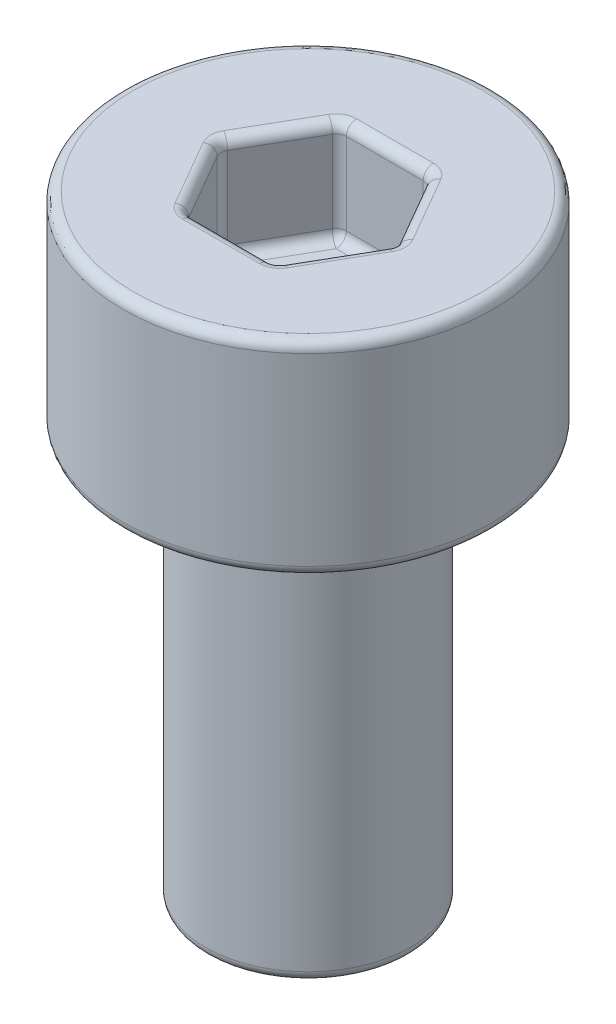
from build123d import *

# Parameters (mm, degrees)
SKETCH1_R           = 2
BOSS_EXTRUDE1_DEPTH = 8
SKETCH2_R           = 3.61
BOSS_EXTRUDE2_DEPTH = 4
CUT_EXTRUDE1_DEPTH  = 2
FILLET1_R           = 0.2


with BuildPart() as part:
    # Sketch1 → Boss-Extrude1 (new body)
    with BuildSketch(Plane(origin=(0, 0, 0), x_dir=(1, 0, 0), z_dir=(0, 1, 0))):
        with Locations(Location((0, 0, 0), (0, 0, 270))):
            Circle(SKETCH1_R)
    extrude(amount=-BOSS_EXTRUDE1_DEPTH)

    # Sketch2 → Boss-Extrude2 (add)
    with BuildSketch(Plane(origin=(0, 0, 0), x_dir=(1, 0, 0), z_dir=(0, 1, 0))):
        with Locations(Location((0, 0, 0), (0, 0, 270))):
            Circle(SKETCH2_R)
    extrude(amount=BOSS_EXTRUDE2_DEPTH)

    # Sketch3 → Cut-Extrude1 (cut)
    with BuildSketch(Plane(origin=(0, 4, 0), x_dir=(1, 0, 0), z_dir=(0, 1, 0))):
        Polygon((1.732050808, 0), (0.866025404, 1.5), (-0.866025404, 1.5), (-1.732050808, 0), (-0.866025404, -1.5), (0.866025404, -1.5), align=None)
    extrude(amount=-CUT_EXTRUDE1_DEPTH, mode=Mode.SUBTRACT)

    # Fillet1
    fillet1_edges = [part.edges().sort_by_distance(p)[0] for p in [
        (1.299038106, 2, 0.75),
        (1.732050808, 3, 0),
        (0, 2, 1.5),
        (0.866025404, 3, 1.5),
        (-1.299038106, 2, 0.75),
        (-0.866025404, 3, 1.5),
        (-1.299038106, 2, -0.75),
        (-1.732050808, 3, 0),
        (0, 2, -1.5),
        (-0.866025404, 3, -1.5),
        (1.299038106, 2, -0.75),
        (0.866025404, 3, -1.5),
        (1.299038106, 4, 0.75),
        (1.299038106, 4, -0.75),
        (0, 4, -1.5),
        (-1.299038106, 4, -0.75),
        (-1.299038106, 4, 0.75),
        (0, 4, 1.5),
        (0, -8, -2),
        (0, 0, -3.61),
        (0, 4, -3.61),
    ]]
    fillet(fillet1_edges, radius=FILLET1_R)


solid = part.part
